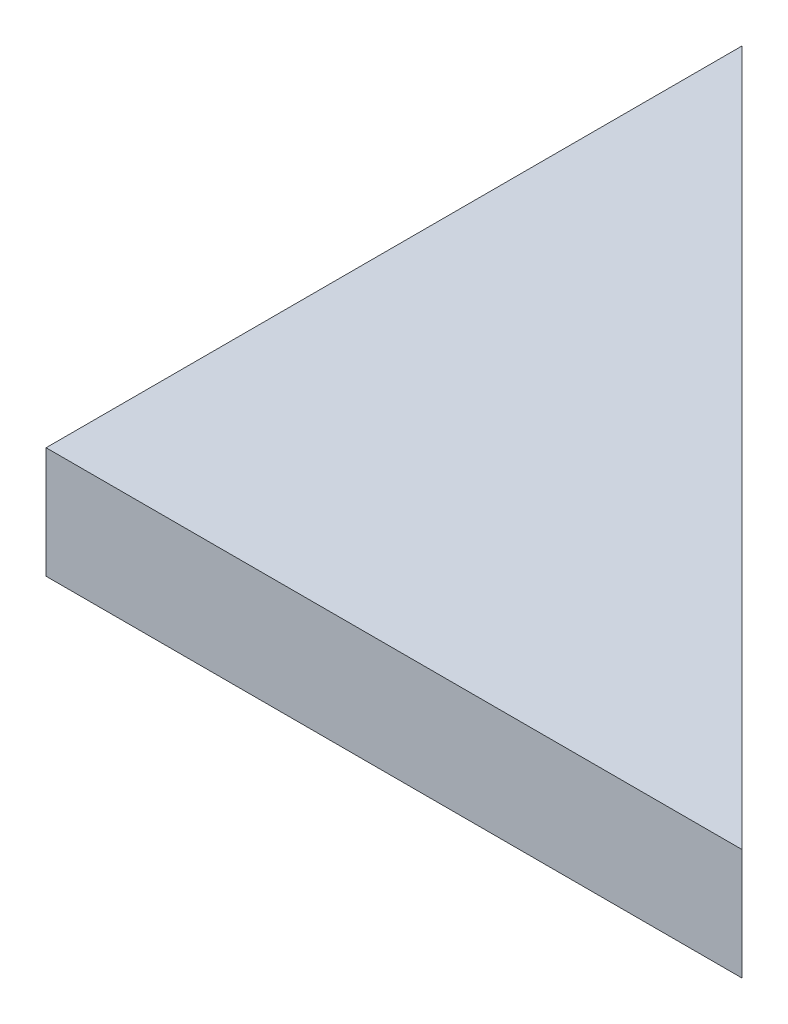
from build123d import *

# Parameters (mm, degrees)
EXTRUDE_1_DEPTH = 4


with BuildPart() as part:
    # Эскиз1 → Вытянуть1 (new body)
    with BuildSketch(Plane(origin=(0, 0, 0), x_dir=(1, 0, 0), z_dir=(0, 1, 0))):
        Polygon((0, 0), (0, 25), (25, 0), align=None)
    extrude(amount=EXTRUDE_1_DEPTH)


solid = part.part
